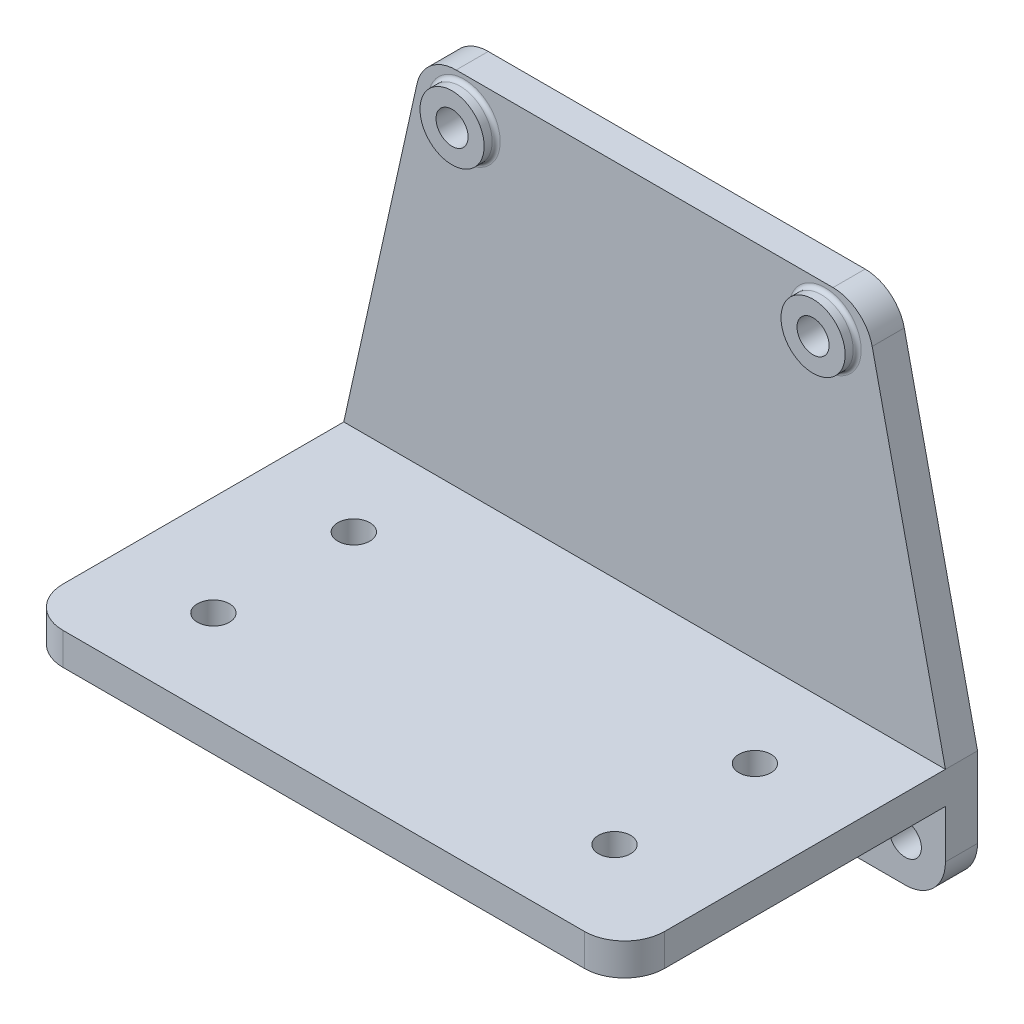
from build123d import *

# Parameters (mm, degrees)
EXTRUDE_1_DEPTH     = 8
SKETCH_2_R          = 4
CUT_EXTRUDE_1_DEPTH = 142.73566947
SKETCH_3_W          = 75
SKETCH_3_H          = 8
EXTRUDE_2_DEPTH     = 80
SKETCH_5_R          = 4
CUT_EXTRUDE_2_DEPTH = 147.523035732
RIB_1_REACH         = 156.091
SKETCH_6_WALL_W     = 393.151638598
SKETCH_6_WALL_H     = 8
FILLET_2_R          = 10
EXTRUDE_START       = 3
SKETCH_7_R          = 8
SKETCH_7_R_2        = 4
EXTRUDE_3_DEPTH     = 3
FILLET_3_R          = 1
FILLET_4_R          = 8


with BuildPart() as part:
    # Эскиз1 → Бобышка-Вытянуть1 (new body)
    with BuildSketch(Plane.XY):
        Polygon((0, 0), (75, 0), (75, 30), (55, 120), (0, 120), align=None)
    extrude(amount=EXTRUDE_1_DEPTH)

    # Эскиз2 → Вырез-Вытянуть1 (cut, through all)
    with BuildSketch(Plane.XY.offset(8)):
        with Locations((45, 110)):
            Circle(SKETCH_2_R)
        with Locations((0, 10)):
            Circle(SKETCH_2_R)
        with Locations((65, 10)):
            Circle(SKETCH_2_R)
    extrude(amount=-CUT_EXTRUDE_1_DEPTH, mode=Mode.SUBTRACT)

    # Эскиз3 → Бобышка-Вытянуть2 (add)
    with BuildSketch(Plane.XY.offset(8)):
        with Locations((37.5, 26)):
            Rectangle(SKETCH_3_W, SKETCH_3_H)
    extrude(amount=EXTRUDE_2_DEPTH)

    # Эскиз5 → Вырез-Вытянуть2 (cut, through all)
    with BuildSketch(Plane(origin=(0, 30, 0), x_dir=(1, 0, 0), z_dir=(0, 1, 0))):
        with Locations(Location((50, -30.5, 0), (0, 0, 270))):
            Circle(SKETCH_5_R)
        with Locations(Location((50, -65.5, 0), (0, 0, 270))):
            Circle(SKETCH_5_R)
    extrude(amount=-CUT_EXTRUDE_2_DEPTH, mode=Mode.SUBTRACT)

    # Эскиз6 wall → Ребро1 (add, up to next)
    with BuildSketch(Plane(origin=(35, 11, 48), x_dir=(0, -0.265156483021, -0.964205392804), z_dir=(0, 0.964205392804, -0.265156483021)), mode=Mode.PRIVATE) as rib_1_sk1:
        Rectangle(SKETCH_6_WALL_W, SKETCH_6_WALL_H)
    rib_1_tool1 = extrude(rib_1_sk1.sketch, amount=RIB_1_REACH, mode=Mode.PRIVATE) - part.part
    add(rib_1_tool1.solids().sort_by_distance((35, 11, 48))[0])

    # Скругление2
    fillet_2_edges = [part.edges().sort_by_distance(p)[0] for p in [
        (55, 120, 4),
        (75, 0, 4),
        (75, 26, 88),
    ]]
    fillet(fillet_2_edges, radius=FILLET_2_R)

    # Зеркальное отражение1: part across plane


with BuildPart() as part_1:
    add(part.part)
    add(part.part.mirror(Plane(origin=(0, 120, 8), x_dir=(0, 0, 1), z_dir=(1, 0, 0))))

    # Эскиз7 → Бобышка-Вытянуть3 (add)
    # profile 1 of 2: a face of its own
    with BuildSketch(Plane.XY.offset(8).offset(EXTRUDE_START)):
        with Locations((-45, 110)):
            Circle(SKETCH_7_R)
        with Locations(Location((-45, 110, 0), (0, 0, 180))):
            Circle(SKETCH_7_R_2, mode=Mode.SUBTRACT)
    # profile 2 of 2: a face of its own
    with BuildSketch(Plane.XY.offset(8).offset(EXTRUDE_START)):
        with Locations((45, 110)):
            Circle(SKETCH_7_R)
        with Locations((45, 110)):
            Circle(SKETCH_7_R_2, mode=Mode.SUBTRACT)
    extrude(amount=-EXTRUDE_3_DEPTH)

    # Скругление3
    fillet_3_edges = [part_1.edges().sort_by_distance(p)[0] for p in [
        (-53, 110, 8),
        (37, 110, 8),
    ]]
    fillet(fillet_3_edges, radius=FILLET_3_R)

    # Скругление4
    fillet_4_edges = [part_1.edges().sort_by_distance(p)[0] for p in [
        (-39, 11, 8),
        (-31, 11, 8),
        (31, 11, 8),
        (39, 11, 8),
    ]]
    fillet(fillet_4_edges, radius=FILLET_4_R)


solid = part_1.part
